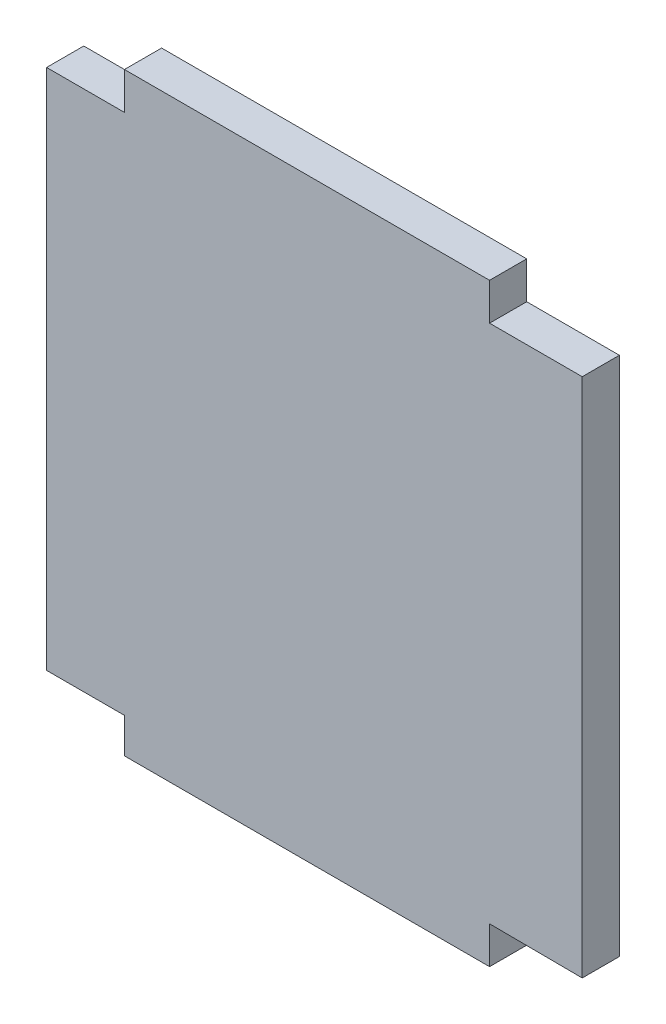
from build123d import *

# Parameters (mm, degrees)
BOSS_EXTRUDE1_DEPTH = 5.08


with BuildPart() as part:
    # Sketch1 → Boss-Extrude1 (new body)
    with BuildSketch(Plane.XY):
        Polygon((-60.783269637, 39.711666867), (-60.783269637, 44.511306035), (-71.426249191, 44.511306035), (-71.426249191, 115.911666867), (-60.783269637, 115.911666867), (-60.783269637, 120.991666867), (-10.859370826, 120.991666867), (-10.859370826, 115.911666867), (1.813782259, 115.911666867), (1.813782259, 44.70791048), (-10.859370826, 44.791666867), (-10.859370826, 39.711666867), align=None)
    extrude(amount=BOSS_EXTRUDE1_DEPTH)


solid = part.part
